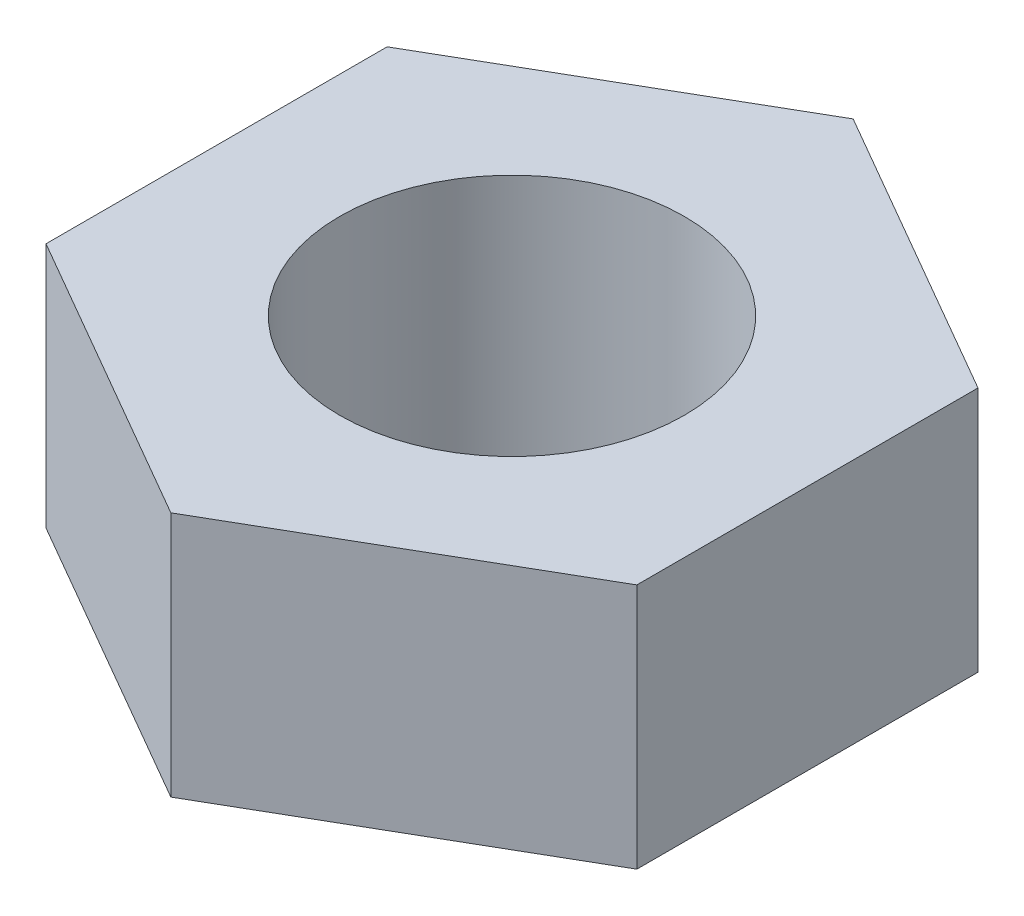
from build123d import *

# Parameters (mm, degrees)
BOSS_EXTRUDE1_DEPTH = 10
SKETCH2_R           = 7
CUT_EXTRUDE1_DEPTH  = 10


with BuildPart() as part:
    # Sketch1 → Boss-Extrude1 (new body)
    with BuildSketch(Plane(origin=(0, 0, 0), x_dir=(1, 0, 0), z_dir=(0, 1, 0))):
        Polygon((0, 13.856406461), (-12, 6.92820323), (-12, -6.92820323), (0, -13.856406461), (12, -6.92820323), (12, 6.92820323), align=None)
    extrude(amount=BOSS_EXTRUDE1_DEPTH)

    # Sketch2 → Cut-Extrude1 (cut)
    with BuildSketch(Plane(origin=(0, 10, 0), x_dir=(1, 0, 0), z_dir=(0, 1, 0))):
        with Locations(Location((0, 0, 0), (0, 0, 270))):
            Circle(SKETCH2_R)
    extrude(amount=-CUT_EXTRUDE1_DEPTH, mode=Mode.SUBTRACT)


solid = part.part
